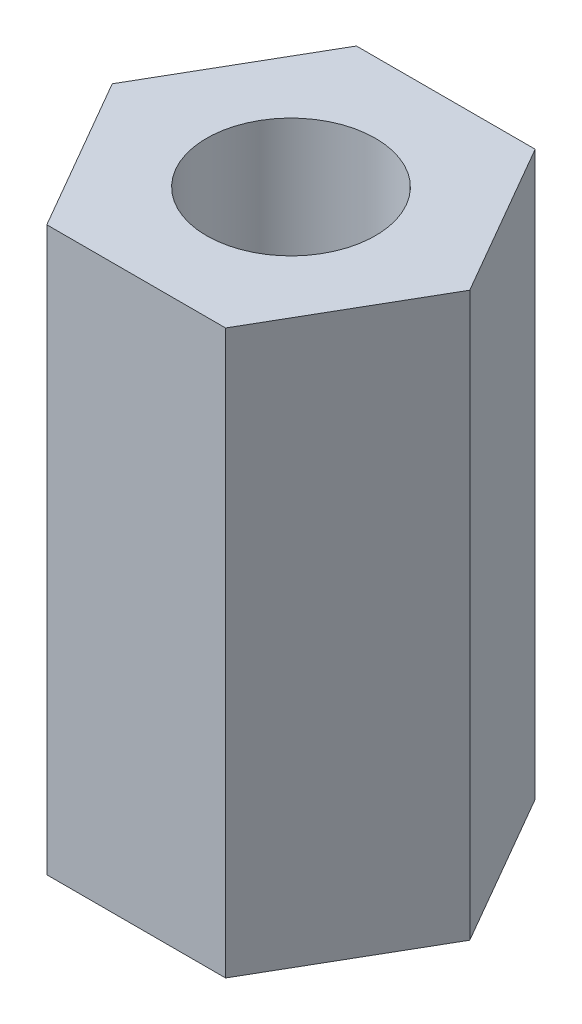
from build123d import *

# Parameters (mm, degrees)
SKETCH_1_R      = 1.5
EXTRUDE_1_DEPTH = 10


with BuildPart() as part:
    # 草图1 → 凸台-拉伸1 (new body)
    with BuildSketch(Plane(origin=(0, 0, 0), x_dir=(1, 0, 0), z_dir=(0, 1, 0))):
        Polygon((3.175426481, 0), (1.58771324, 2.75), (-1.58771324, 2.75), (-3.175426481, 0), (-1.58771324, -2.75), (1.58771324, -2.75), align=None)
        with Locations(Location((0, 0, 0), (0, 0, 270))):
            Circle(SKETCH_1_R, mode=Mode.SUBTRACT)
    extrude(amount=EXTRUDE_1_DEPTH)


solid = part.part
